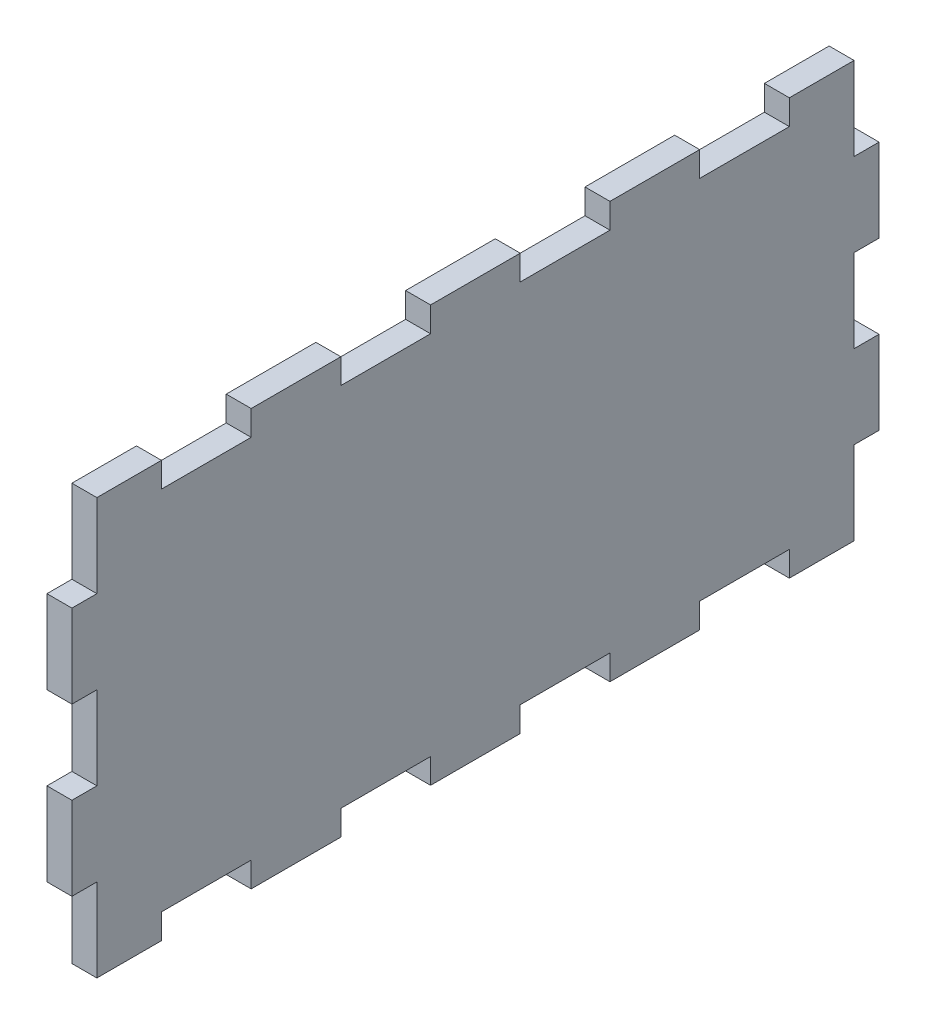
from build123d import *

# Parameters (mm, degrees)
ESBO_O1_W                = 97
ESBO_O1_H                = 50
RESSALTO_EXTRUS_O1_DEPTH = 3
CORTE_EXTRUS_O1_REACH    = 56.647
ESBO_O2_W                = 10.782222222
ESBO_O2_H                = 3
CORTE_EXTRUS_O2_REACH    = 56.647
ESBO_O4_W                = 3
ESBO_O4_H                = 10


with BuildPart() as part:
    # Esboço1 → Ressalto-extrusão1 (new body)
    with BuildSketch(Plane(origin=(0, 0, 0), x_dir=(0, 0, -1), z_dir=(1, 0, 0))):
        Rectangle(ESBO_O1_W, ESBO_O1_H)
    extrude(amount=RESSALTO_EXTRUS_O1_DEPTH)

    # Esboço2 → Corte-extrusão1 (cut, up to next)
    with BuildSketch(Plane.ZY, mode=Mode.PRIVATE) as corte_extrus_o1_sk1:
        with Locations((-10.771111111, 23.5)):
            Rectangle(ESBO_O2_W, ESBO_O2_H)
    corte_extrus_o1_tool1 = extrude(corte_extrus_o1_sk1.sketch, amount=-CORTE_EXTRUS_O1_REACH, mode=Mode.PRIVATE) & part.part
    # Esboço2 → Corte-extrusão1 (cut, up to next)
    with BuildSketch(Plane.ZY, mode=Mode.PRIVATE) as corte_extrus_o1_sk2:
        with Locations((-32.331111111, 23.5)):
            Rectangle(ESBO_O2_W, ESBO_O2_H)
    corte_extrus_o1_tool2 = extrude(corte_extrus_o1_sk2.sketch, amount=-CORTE_EXTRUS_O1_REACH, mode=Mode.PRIVATE) & part.part
    # Esboço2 → Corte-extrusão1 (cut, up to next)
    with BuildSketch(Plane.ZY, mode=Mode.PRIVATE) as corte_extrus_o1_sk3:
        with Locations((10.788888889, 23.5)):
            Rectangle(ESBO_O2_W, ESBO_O2_H)
    corte_extrus_o1_tool3 = extrude(corte_extrus_o1_sk3.sketch, amount=-CORTE_EXTRUS_O1_REACH, mode=Mode.PRIVATE) & part.part
    # Esboço2 → Corte-extrusão1 (cut, up to next)
    with BuildSketch(Plane.ZY, mode=Mode.PRIVATE) as corte_extrus_o1_sk4:
        with Locations((32.348888889, 23.5)):
            Rectangle(ESBO_O2_W, ESBO_O2_H)
    corte_extrus_o1_tool4 = extrude(corte_extrus_o1_sk4.sketch, amount=-CORTE_EXTRUS_O1_REACH, mode=Mode.PRIVATE) & part.part
    # Esboço2 → Corte-extrusão1 (cut, up to next)
    with BuildSketch(Plane.ZY, mode=Mode.PRIVATE) as corte_extrus_o1_sk5:
        with Locations((-32.331111111, -23.5)):
            Rectangle(ESBO_O2_W, ESBO_O2_H)
    corte_extrus_o1_tool5 = extrude(corte_extrus_o1_sk5.sketch, amount=-CORTE_EXTRUS_O1_REACH, mode=Mode.PRIVATE) & part.part
    # Esboço2 → Corte-extrusão1 (cut, up to next)
    with BuildSketch(Plane.ZY, mode=Mode.PRIVATE) as corte_extrus_o1_sk6:
        with Locations((32.348888889, -23.5)):
            Rectangle(ESBO_O2_W, ESBO_O2_H)
    corte_extrus_o1_tool6 = extrude(corte_extrus_o1_sk6.sketch, amount=-CORTE_EXTRUS_O1_REACH, mode=Mode.PRIVATE) & part.part
    # Esboço2 → Corte-extrusão1 (cut, up to next)
    with BuildSketch(Plane.ZY, mode=Mode.PRIVATE) as corte_extrus_o1_sk7:
        with Locations((-10.771111111, -23.5)):
            Rectangle(ESBO_O2_W, ESBO_O2_H)
    corte_extrus_o1_tool7 = extrude(corte_extrus_o1_sk7.sketch, amount=-CORTE_EXTRUS_O1_REACH, mode=Mode.PRIVATE) & part.part
    # Esboço2 → Corte-extrusão1 (cut, up to next)
    with BuildSketch(Plane.ZY, mode=Mode.PRIVATE) as corte_extrus_o1_sk8:
        with Locations((10.788888889, -23.5)):
            Rectangle(ESBO_O2_W, ESBO_O2_H)
    corte_extrus_o1_tool8 = extrude(corte_extrus_o1_sk8.sketch, amount=-CORTE_EXTRUS_O1_REACH, mode=Mode.PRIVATE) & part.part
    add(corte_extrus_o1_tool1.solids().sort_by_distance((0, 23.5, -10.771111))[0], mode=Mode.SUBTRACT)
    add(corte_extrus_o1_tool2.solids().sort_by_distance((0, 23.5, -32.331111))[0], mode=Mode.SUBTRACT)
    add(corte_extrus_o1_tool3.solids().sort_by_distance((0, 23.5, 10.788889))[0], mode=Mode.SUBTRACT)
    add(corte_extrus_o1_tool4.solids().sort_by_distance((0, 23.5, 32.348889))[0], mode=Mode.SUBTRACT)
    add(corte_extrus_o1_tool5.solids().sort_by_distance((0, -23.5, -32.331111))[0], mode=Mode.SUBTRACT)
    add(corte_extrus_o1_tool6.solids().sort_by_distance((0, -23.5, 32.348889))[0], mode=Mode.SUBTRACT)
    add(corte_extrus_o1_tool7.solids().sort_by_distance((0, -23.5, -10.771111))[0], mode=Mode.SUBTRACT)
    add(corte_extrus_o1_tool8.solids().sort_by_distance((0, -23.5, 10.788889))[0], mode=Mode.SUBTRACT)

    # Esboço4 → Corte-extrusão2 (cut, up to next)
    with BuildSketch(Plane.ZY, mode=Mode.PRIVATE) as corte_extrus_o2_sk1:
        with Locations((47, 20)):
            Rectangle(ESBO_O4_W, ESBO_O4_H)
    corte_extrus_o2_tool1 = extrude(corte_extrus_o2_sk1.sketch, amount=-CORTE_EXTRUS_O2_REACH, mode=Mode.PRIVATE) & part.part
    # Esboço4 → Corte-extrusão2 (cut, up to next)
    with BuildSketch(Plane.ZY, mode=Mode.PRIVATE) as corte_extrus_o2_sk2:
        with Locations((47, -20)):
            Rectangle(ESBO_O4_W, ESBO_O4_H)
    corte_extrus_o2_tool2 = extrude(corte_extrus_o2_sk2.sketch, amount=-CORTE_EXTRUS_O2_REACH, mode=Mode.PRIVATE) & part.part
    # Esboço4 → Corte-extrusão2 (cut, up to next)
    with BuildSketch(Plane.ZY, mode=Mode.PRIVATE) as corte_extrus_o2_sk3:
        with Locations((-47, 0)):
            Rectangle(ESBO_O4_W, ESBO_O4_H)
    corte_extrus_o2_tool3 = extrude(corte_extrus_o2_sk3.sketch, amount=-CORTE_EXTRUS_O2_REACH, mode=Mode.PRIVATE) & part.part
    # Esboço4 → Corte-extrusão2 (cut, up to next)
    with BuildSketch(Plane.ZY, mode=Mode.PRIVATE) as corte_extrus_o2_sk4:
        with Locations((-47, 20)):
            Rectangle(ESBO_O4_W, ESBO_O4_H)
    corte_extrus_o2_tool4 = extrude(corte_extrus_o2_sk4.sketch, amount=-CORTE_EXTRUS_O2_REACH, mode=Mode.PRIVATE) & part.part
    # Esboço4 → Corte-extrusão2 (cut, up to next)
    with BuildSketch(Plane.ZY, mode=Mode.PRIVATE) as corte_extrus_o2_sk5:
        with Locations((47, 0)):
            Rectangle(ESBO_O4_W, ESBO_O4_H)
    corte_extrus_o2_tool5 = extrude(corte_extrus_o2_sk5.sketch, amount=-CORTE_EXTRUS_O2_REACH, mode=Mode.PRIVATE) & part.part
    # Esboço4 → Corte-extrusão2 (cut, up to next)
    with BuildSketch(Plane.ZY, mode=Mode.PRIVATE) as corte_extrus_o2_sk6:
        with Locations((-47, -20)):
            Rectangle(ESBO_O4_W, ESBO_O4_H)
    corte_extrus_o2_tool6 = extrude(corte_extrus_o2_sk6.sketch, amount=-CORTE_EXTRUS_O2_REACH, mode=Mode.PRIVATE) & part.part
    add(corte_extrus_o2_tool1.solids().sort_by_distance((0, 20, 47))[0], mode=Mode.SUBTRACT)
    add(corte_extrus_o2_tool2.solids().sort_by_distance((0, -20, 47))[0], mode=Mode.SUBTRACT)
    add(corte_extrus_o2_tool3.solids().sort_by_distance((0, 0, -47))[0], mode=Mode.SUBTRACT)
    add(corte_extrus_o2_tool4.solids().sort_by_distance((0, 20, -47))[0], mode=Mode.SUBTRACT)
    add(corte_extrus_o2_tool5.solids().sort_by_distance((0, 0, 47))[0], mode=Mode.SUBTRACT)
    add(corte_extrus_o2_tool6.solids().sort_by_distance((0, -20, -47))[0], mode=Mode.SUBTRACT)


solid = part.part
